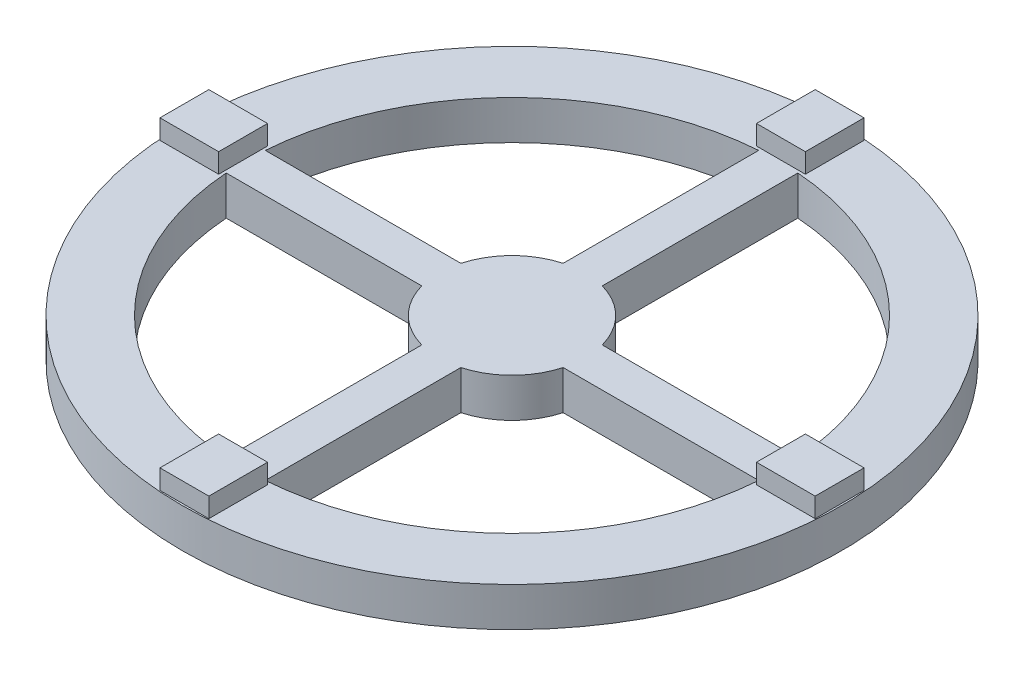
from build123d import *

# Parameters (mm, degrees)
SKETCH2_R           = 20
SKETCH3_W           = 40
SKETCH3_H           = 40
BOSS_EXTRUDE1_DEPTH = 225
CIRPATTERN1_COUNT   = 4
SKETCH8_R           = 337
SKETCH8_R_2         = 273
BOSS_EXTRUDE3_DEPTH = 20
BOSS_EXTRUDE4_DEPTH = 20
SKETCH12_W          = 60
SKETCH12_H          = 50
SKETCH12_W_2        = 50
SKETCH12_H_2        = 60
BOSS_EXTRUDE5_DEPTH = 20


with BuildPart() as part:
    # Sketch2 → Revolve1 (revolve)
    with BuildSketch(Plane.XY, mode=Mode.PRIVATE) as revolve1_sk:
        with Locations((300, 0)):
            Circle(SKETCH2_R)
    revolve(revolve1_sk.sketch.rotate(Axis((0, 0, 0), (0, 1, 0)), 90), axis=Axis((0, 0, 0), (0, 1, 0)))

    # Sketch3 → Boss-Extrude1 (add)
    with BuildSketch(Plane.XY.offset(300)):
        Rectangle(SKETCH3_W, SKETCH3_H)
    boss_extrude1 = extrude(amount=-BOSS_EXTRUDE1_DEPTH)

    # CirPattern1: Boss-Extrude1 ×4 about axis
    cirpattern1_axis = Axis((0, 0, 0), (0, 1, 0))
    for i in range(1, CIRPATTERN1_COUNT):
        add(boss_extrude1.rotate(cirpattern1_axis, i * 360 / CIRPATTERN1_COUNT))

    # Sketch8 → Boss-Extrude3 (add, symmetric)
    with BuildSketch(Plane(origin=(0, 0, 0), x_dir=(1, 0, 0), z_dir=(0, 1, 0))):
        with Locations(Location((0, 0, 0), (0, 0, 270))):
            Circle(SKETCH8_R)
        Circle(SKETCH8_R_2, mode=Mode.SUBTRACT)
    extrude(amount=BOSS_EXTRUDE3_DEPTH, both=True)

    # Sketch9 → Boss-Extrude4 (add, symmetric)
    with BuildSketch(Plane(origin=(0, 0, 0), x_dir=(1, 0, 0), z_dir=(0, 1, 0))):
        with BuildLine():
            Line((-20, -75), (-20, -72.284161474))
            ThreePointArc((-20, -72.284161474), (-53.033008589, -53.033008589), (-72.284161474, -20))
            Line((-72.284161474, -20), (-75, -20))
            Line((-75, -20), (-75, 20))
            Line((-75, 20), (-72.284161474, 20))
            ThreePointArc((-72.284161474, 20), (-53.033008589, 53.033008589), (-20, 72.284161474))
            Line((-20, 72.284161474), (-20, 75))
            Line((-20, 75), (20, 75))
            Line((20, 75), (20, 72.284161474))
            ThreePointArc((20, 72.284161474), (53.033008589, 53.033008589), (72.284161474, 20))
            Line((72.284161474, 20), (75, 20))
            Line((75, 20), (75, -20))
            Line((75, -20), (72.284161474, -20))
            ThreePointArc((72.284161474, -20), (53.033008589, -53.033008589), (20, -72.284161474))
            Line((20, -72.284161474), (20, -75))
            Line((20, -75), (-20, -75))
        make_face()
    extrude(amount=BOSS_EXTRUDE4_DEPTH, both=True)

    # Sketch12 → Boss-Extrude5 (add)
    with BuildSketch(Plane(origin=(0, 20, 0), x_dir=(1, 0, 0), z_dir=(0, 1, 0))):
        with Locations((305, 0)):
            Rectangle(SKETCH12_W, SKETCH12_H)
        with Locations((0, -305)):
            Rectangle(SKETCH12_W_2, SKETCH12_H_2)
        with Locations((-305, 0)):
            Rectangle(SKETCH12_W, SKETCH12_H)
        with Locations((0, 305)):
            Rectangle(SKETCH12_W_2, SKETCH12_H_2)
    extrude(amount=BOSS_EXTRUDE5_DEPTH)


solid = part.part
